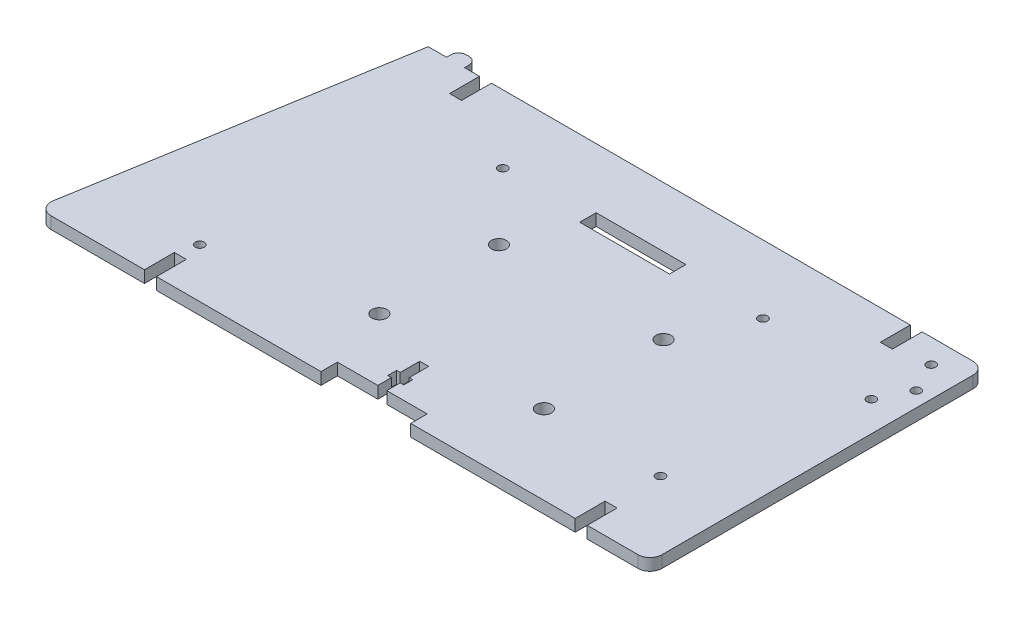
from build123d import *

# Parameters (mm, degrees)
SKETCH1_R           = 1.5
SKETCH1_R_2         = 2.5
SKETCH1_W           = 30
SKETCH1_H           = 5.5
BOSS_EXTRUDE1_DEPTH = 4
FILLET1_R           = 4
FILLET3_R           = 4
FILLET4_R           = 4
FILLET5_R           = 2.5


with BuildPart() as part:
    # Sketch1 → Boss-Extrude1 (new body)
    with BuildSketch(Plane(origin=(0, 0, 0), x_dir=(1, 0, 0), z_dir=(0, 1, 0))):
        Polygon((158.5, 0), (180, 0), (180, 10), (184, 10), (184, 0), (205, 0), (205, 112), (184, 112), (184, 102), (180, 102), (180, 112), (40, 112), (40, 102), (36, 102), (36, 112), (31, 112), (31, 116), (25, 116), (25, 112), (18.8632, 112), (0, 0), (36, 0), (36, 10), (40, 10), (40, 0), (95, 0), (95, 5.5), (108.5, 5.5), (108.5, 10), (107.3, 10), (107.3, 13), (108.5, 13), (108.5, 19.5), (111.5, 19.5), (111.5, 13), (112.7, 13), (112.7, 10), (111.5, 10), (111.5, 5.5), (125, 5.5), (125, 0), (155.5, 0), align=None)
        with Locations(Location((153.5, 89.25, 0), (0, 0, 270))):
            Circle(SKETCH1_R, mode=Mode.SUBTRACT)
        with Locations(Location((66.5, 89.25, 0), (0, 0, 270))):
            Circle(SKETCH1_R, mode=Mode.SUBTRACT)
        with Locations(Location((88, 66.5, 0), (0, 0, 270))):
            Circle(SKETCH1_R_2, mode=Mode.SUBTRACT)
        with Locations(Location((88.007190659, 26.500000646, 0), (0, 0, 270))):
            Circle(SKETCH1_R_2, mode=Mode.SUBTRACT)
        with Locations(Location((143, 66.5, 0), (0, 0, 270))):
            Circle(SKETCH1_R_2, mode=Mode.SUBTRACT)
        with Locations(Location((143.007190659, 26.500000646, 0), (0, 0, 270))):
            Circle(SKETCH1_R_2, mode=Mode.SUBTRACT)
        with Locations(Location((195, 104, 0), (0, 0, 270))):
            Circle(SKETCH1_R, mode=Mode.SUBTRACT)
        with Locations(Location((195, 84, 0), (0, 0, 270))):
            Circle(SKETCH1_R, mode=Mode.SUBTRACT)
        with Locations(Location((200, 94, 0), (0, 0, 270))):
            Circle(SKETCH1_R, mode=Mode.SUBTRACT)
        with Locations(Location((182, 26.5, 0), (0, 0, 270))):
            Circle(SKETCH1_R, mode=Mode.SUBTRACT)
        with Locations(Location((38, 16.5, 0), (0, 0, 270))):
            Circle(SKETCH1_R, mode=Mode.SUBTRACT)
        with Locations((110, 89.25)):
            Rectangle(SKETCH1_W, SKETCH1_H, mode=Mode.SUBTRACT)
    extrude(amount=BOSS_EXTRUDE1_DEPTH)

    # Fillet1
    fillet1_edges = [part.edges().sort_by_distance(p)[0] for p in [
        (0, 2, 0),
    ]]
    fillet(fillet1_edges, radius=FILLET1_R)

    # Fillet3
    fillet3_edges = [part.edges().sort_by_distance(p)[0] for p in [
        (205, 2, -112),
    ]]
    fillet(fillet3_edges, radius=FILLET3_R)

    # Fillet4
    fillet4_edges = [part.edges().sort_by_distance(p)[0] for p in [
        (205, 2, 0),
    ]]
    fillet(fillet4_edges, radius=FILLET4_R)

    # Fillet5
    fillet5_edges = [part.edges().sort_by_distance(p)[0] for p in [
        (25, 2, -116),
        (31, 2, -116),
    ]]
    fillet(fillet5_edges, radius=FILLET5_R)


solid = part.part
